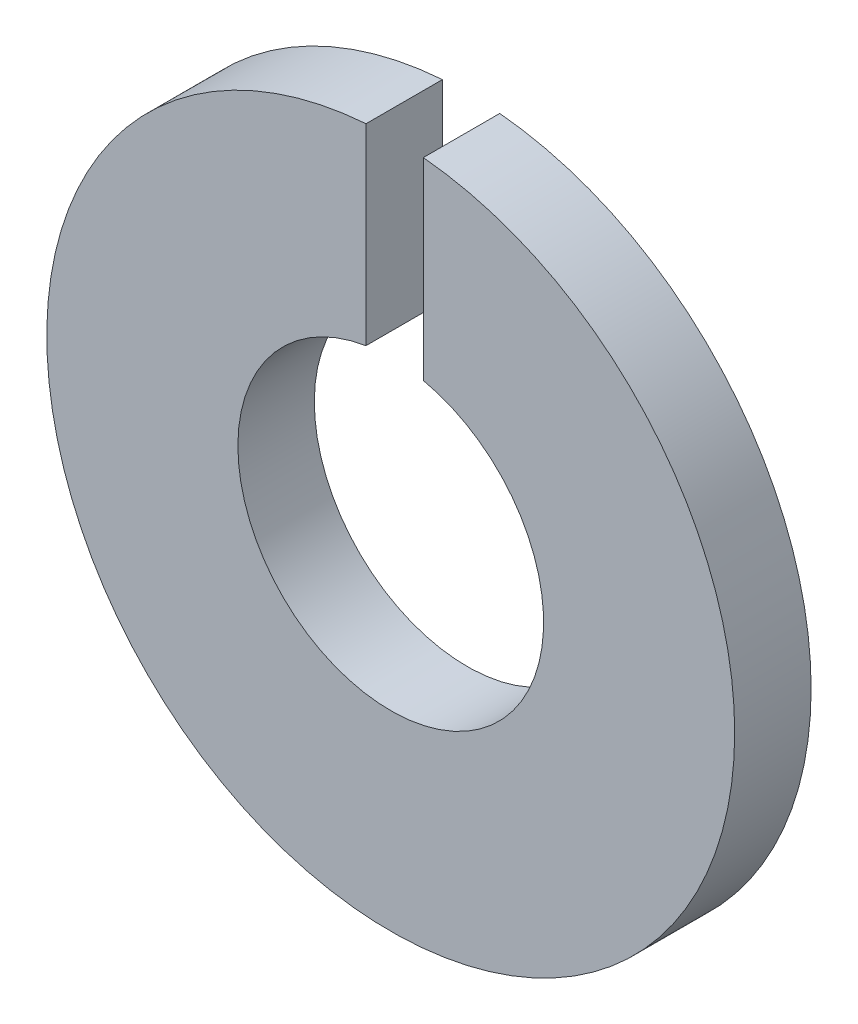
from build123d import *

# Parameters (mm, degrees)
BOSS_EXTRUDE1_DEPTH = 2


with BuildPart() as part:
    # Sketch1 → Boss-Extrude1 (new body)
    with BuildSketch(Plane.XY):
        with BuildLine():
            Line((-0.647749549, 8.976659764), (-0.647749549, 3.94720414))
            ThreePointArc((-0.647749549, 3.94720414), (-0.104097931, -3.998645223), (0.852250451, 3.90815419))
            Line((0.852250451, 3.90815419), (0.852250451, 8.95955742))
            ThreePointArc((0.852250451, 8.95955742), (-0.102607394, -8.999415077), (-0.647749549, 8.976659764))
        make_face()
    extrude(amount=BOSS_EXTRUDE1_DEPTH)


solid = part.part
